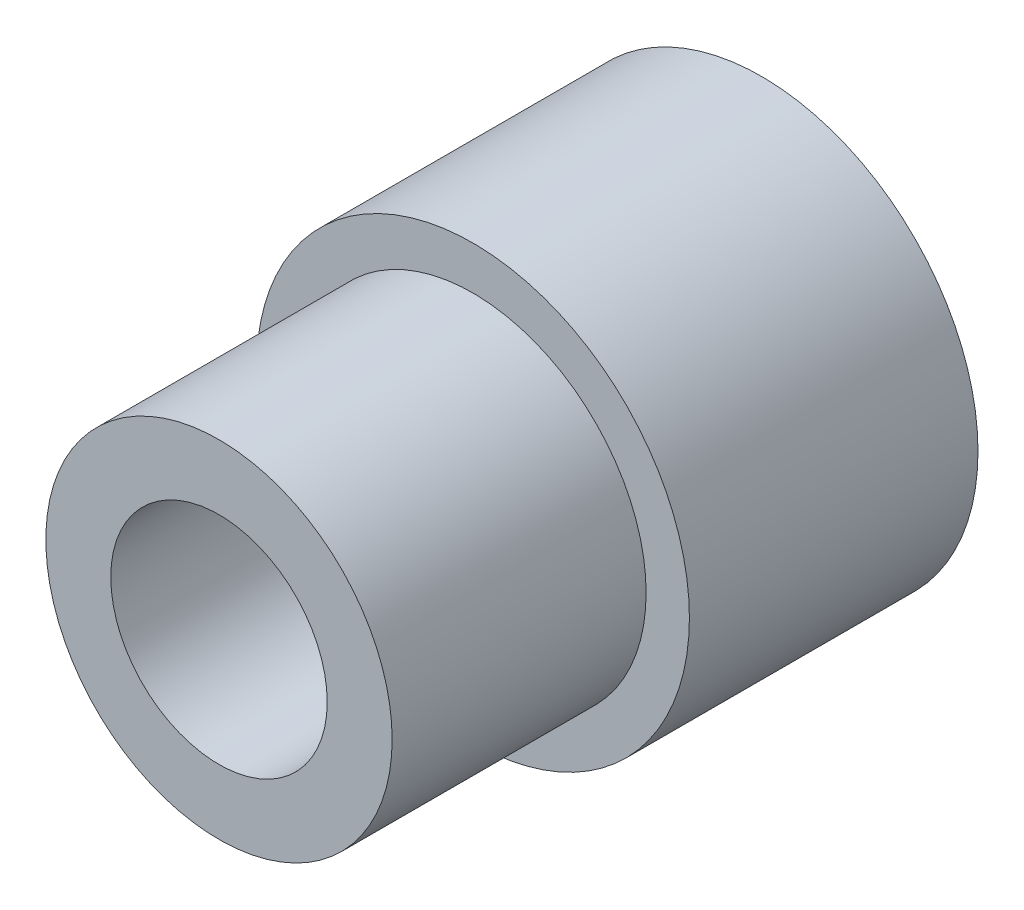
from build123d import *

# Parameters (mm, degrees)
SKETCH1_R           = 9.525
BOSS_EXTRUDE1_DEPTH = 12.7
SKETCH2_R           = 7.62
BOSS_EXTRUDE2_DEPTH = 11.176
SKETCH3_R           = 4.7625
CUT_EXTRUDE1_DEPTH  = 28.413767089


with BuildPart() as part:
    # Sketch1 → Boss-Extrude1 (new body)
    with BuildSketch(Plane.XY):
        Circle(SKETCH1_R)
    extrude(amount=BOSS_EXTRUDE1_DEPTH)

    # Sketch2 → Boss-Extrude2 (add)
    with BuildSketch(Plane.XY.offset(12.7)):
        Circle(SKETCH2_R)
    extrude(amount=BOSS_EXTRUDE2_DEPTH)

    # Sketch3 → Cut-Extrude1 (cut, through all)
    with BuildSketch(Plane.XY.offset(23.876)):
        Circle(SKETCH3_R)
    extrude(amount=-CUT_EXTRUDE1_DEPTH, mode=Mode.SUBTRACT)


solid = part.part
